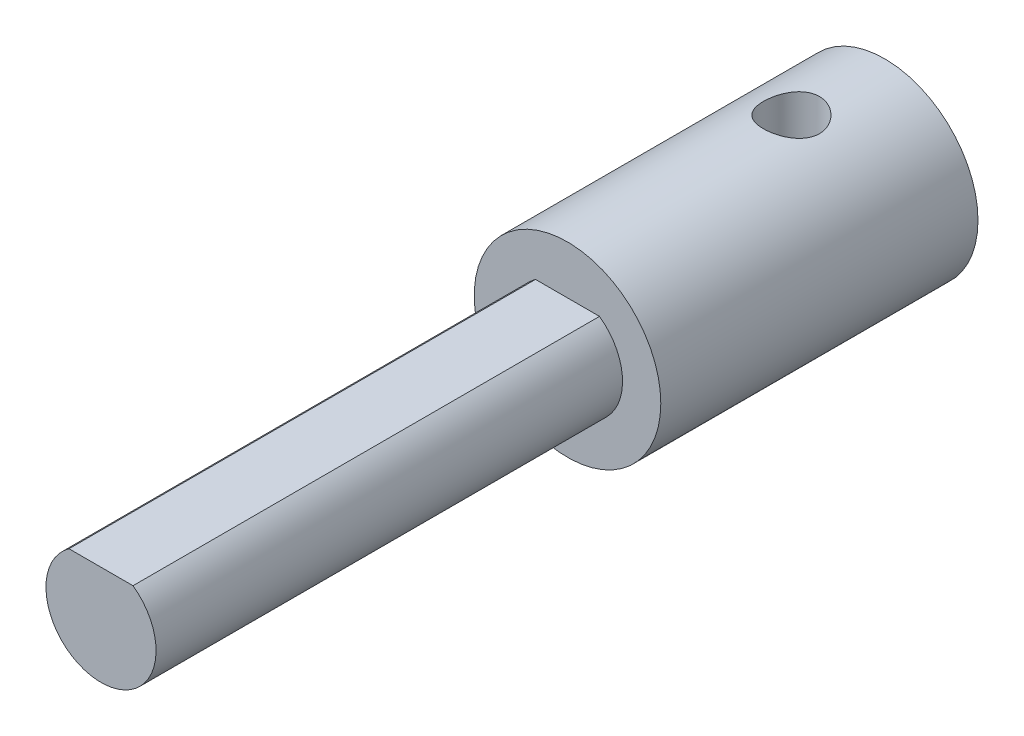
from build123d import *

# Parameters (mm, degrees)
SKETCH1_R               = 5
BOSS_EXTRUDE1_DEPTH     = 15
CUT_EXTRUDE1_REACH      = 18.583
CUT_EXTRUDE1_END_RADIUS = 5
SKETCH3_R               = 1.5
SKETCH4_R               = 5
BOSS_EXTRUDE2_DEPTH     = 2
BOSS_EXTRUDE3_DEPTH     = 25


with BuildPart() as part:
    # Sketch1 → Boss-Extrude1 (new body)
    with BuildSketch(Plane.XY):
        Circle(SKETCH1_R)
        with BuildLine():
            Line((-1.656238208, 2.65), (1.656238208, 2.65))
            ThreePointArc((1.656238208, 2.65), (0, -3.125), (-1.656238208, 2.65))
        make_face(mode=Mode.SUBTRACT)
    extrude(amount=BOSS_EXTRUDE1_DEPTH)

    # Cut-Extrude1: up to this cylinder (the profile starts inside it)
    cut_extrude1_end = Plane(origin=(0, 0, 5), z_dir=(0, 0, -1)) * Cylinder(CUT_EXTRUDE1_END_RADIUS, 48.166, mode=Mode.PRIVATE)
    # Sketch3 → Cut-Extrude1 (cut, up to the surface)
    with BuildSketch(Plane(origin=(0, 0, 0), x_dir=(1, 0, 0), z_dir=(0, 1, 0)), mode=Mode.PRIVATE) as cut_extrude1_sk1:
        with Locations(Location((0, -5, 0), (0, 0, 90))):
            Circle(SKETCH3_R)
    cut_extrude1_tool1 = extrude(cut_extrude1_sk1.sketch, amount=CUT_EXTRUDE1_REACH, mode=Mode.PRIVATE) & cut_extrude1_end
    add(cut_extrude1_tool1.solids().sort_by_distance((0, 0, 5))[0], mode=Mode.SUBTRACT)

    # Sketch4 → Boss-Extrude2 (add)
    with BuildSketch(Plane.XY.offset(15)):
        Circle(SKETCH4_R)
    extrude(amount=BOSS_EXTRUDE2_DEPTH)

    # Sketch6 → Boss-Extrude3 (add)
    with BuildSketch(Plane.XY.offset(17)):
        with BuildLine():
            Line((1.71537168, 2.4), (-1.71537168, 2.4))
            ThreePointArc((-1.71537168, 2.4), (-1.349472776, -2.623246696), (2.95, 0))
            ThreePointArc((2.95, 0), (2.623246696, 1.349472776), (1.71537168, 2.4))
        make_face()
    extrude(amount=BOSS_EXTRUDE3_DEPTH)


solid = part.part
